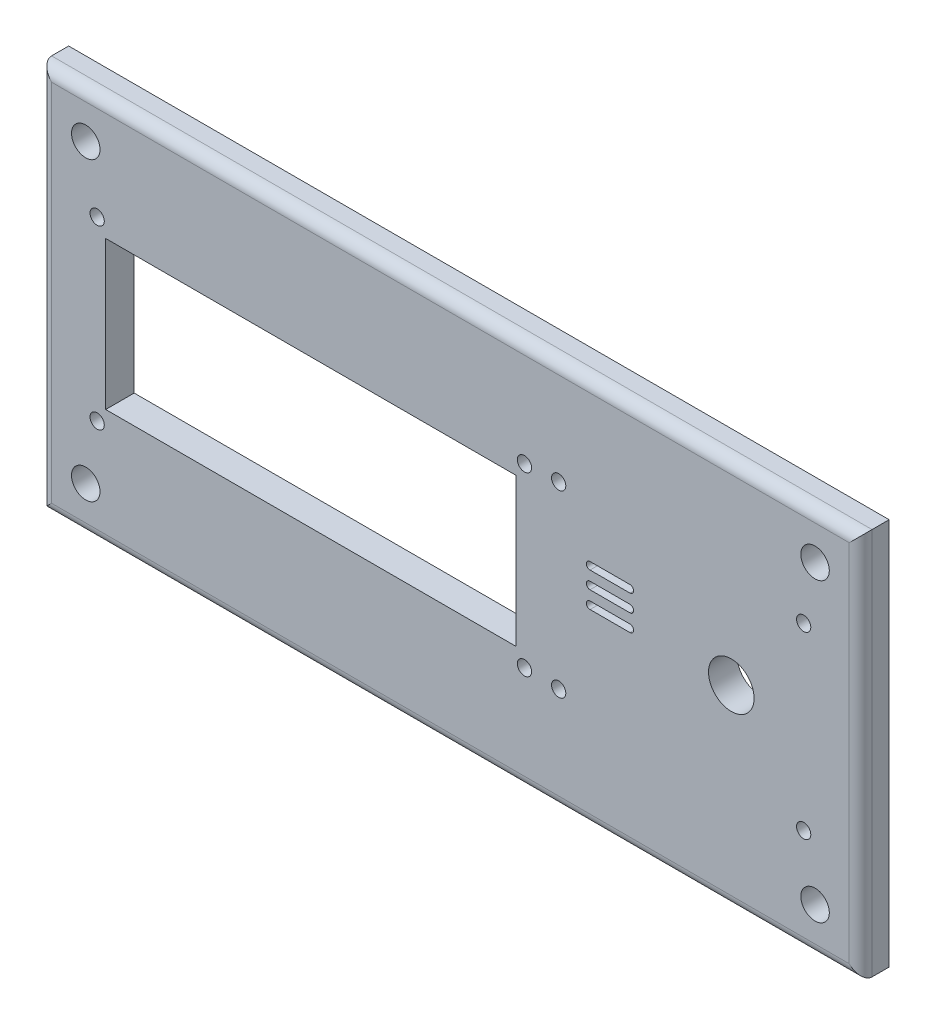
from build123d import *

# Parameters (mm, degrees)
SKETCH_1_W          = 144
SKETCH_1_H          = 68
EXTRUDE_1_DEPTH     = 5
SKETCH_2_R          = 1.25
CUT_EXTRUDE_1_DEPTH = 87.344031922
SKETCH_3_W          = 72
SKETCH_3_H          = 26
CUT_EXTRUDE_2_DEPTH = 87.344031922
SKETCH_5_R          = 1.25
CUT_EXTRUDE_3_DEPTH = 87.344031922
CUT_EXTRUDE_4_DEPTH = 87.344031922
SKETCH_7_R          = 4
CUT_EXTRUDE_5_DEPTH = 87.344031922
SKETCH_8_R          = 2.5
CUT_EXTRUDE_6_DEPTH = 87.344031922
FILLET_1_R          = 2


with BuildPart() as part:
    # Эскиз1 → Бобышка-Вытянуть1 (new body)
    with BuildSketch(Plane.XY):
        with Locations((3.041351056, -8.41565136)):
            Rectangle(SKETCH_1_W, SKETCH_1_H)
    extrude(amount=EXTRUDE_1_DEPTH)

    # Эскиз2 → Вырез-Вытянуть1 (cut, through all)
    with BuildSketch(Plane.XY.offset(5)):
        with Locations((-58.958648944, 7.08434864)):
            Circle(SKETCH_2_R)
        with Locations((-58.958648944, -23.91565136)):
            Circle(SKETCH_2_R)
        with Locations((16.041351056, 7.08434864)):
            Circle(SKETCH_2_R)
        with Locations((16.041351056, -23.91565136)):
            Circle(SKETCH_2_R)
    extrude(amount=-CUT_EXTRUDE_1_DEPTH, mode=Mode.SUBTRACT)

    # Эскиз3 → Вырез-Вытянуть2 (cut, through all)
    with BuildSketch(Plane.XY.offset(5)):
        with Locations((-21.458648944, -8.41565136)):
            Rectangle(SKETCH_3_W, SKETCH_3_H)
    extrude(amount=-CUT_EXTRUDE_2_DEPTH, mode=Mode.SUBTRACT)

    # Эскиз5 → Вырез-Вытянуть3 (cut, through all)
    with BuildSketch(Plane.XY.offset(5)):
        with Locations((22.041351056, -24.16565136)):
            Circle(SKETCH_5_R)
        with Locations((65.041351056, -24.16565136)):
            Circle(SKETCH_5_R)
        with Locations((65.041351056, 7.33434864)):
            Circle(SKETCH_5_R)
        with Locations((22.041351056, 7.33434864)):
            Circle(SKETCH_5_R)
    extrude(amount=-CUT_EXTRUDE_3_DEPTH, mode=Mode.SUBTRACT)

    # Эскиз6 → Вырез-Вытянуть4 (cut, through all)
    with BuildSketch(Plane.XY.offset(5)):
        with BuildLine():
            Line((27.541351056, -8.016688712), (34.541351056, -8.016688712))
            ThreePointArc((34.541351056, -8.016688712), (35.190313704, -8.66565136), (34.541351056, -9.314614008))
            Line((34.541351056, -9.314614008), (27.541351056, -9.314614008))
            ThreePointArc((27.541351056, -9.314614008), (26.892388408, -8.66565136), (27.541351056, -8.016688712))
        make_face()
        with BuildLine():
            Line((27.541351056, -5.016688712), (34.541351056, -5.016688712))
            ThreePointArc((34.541351056, -5.016688712), (35.190313704, -5.66565136), (34.541351056, -6.314614008))
            Line((34.541351056, -6.314614008), (27.541351056, -6.314614008))
            ThreePointArc((27.541351056, -6.314614008), (26.892388408, -5.66565136), (27.541351056, -5.016688712))
        make_face()
        with BuildLine():
            Line((27.541351056, -2.016688712), (34.541351056, -2.016688712))
            ThreePointArc((34.541351056, -2.016688712), (35.190313704, -2.66565136), (34.541351056, -3.314614008))
            Line((34.541351056, -3.314614008), (27.541351056, -3.314614008))
            ThreePointArc((27.541351056, -3.314614008), (26.892388408, -2.66565136), (27.541351056, -2.016688712))
        make_face()
    extrude(amount=-CUT_EXTRUDE_4_DEPTH, mode=Mode.SUBTRACT)

    # Эскиз7 → Вырез-Вытянуть5 (cut, through all)
    with BuildSketch(Plane.XY.offset(5)):
        with Locations((52.341351056, -8.41565136)):
            Circle(SKETCH_7_R)
    extrude(amount=-CUT_EXTRUDE_5_DEPTH, mode=Mode.SUBTRACT)

    # Эскиз8 → Вырез-Вытянуть6 (cut, through all)
    with BuildSketch(Plane.XY.offset(5)):
        with Locations((-60.958648944, 17.58434864)):
            Circle(SKETCH_8_R)
        with Locations((67.041351056, 17.58434864)):
            Circle(SKETCH_8_R)
        with Locations((67.041351056, -34.41565136)):
            Circle(SKETCH_8_R)
        with Locations((-60.958648944, -34.41565136)):
            Circle(SKETCH_8_R)
    extrude(amount=-CUT_EXTRUDE_6_DEPTH, mode=Mode.SUBTRACT)

    # Скругление1
    fillet_1_edges = [part.edges().sort_by_distance(p)[0] for p in [
        (75.041351056, -8.41565136, 5),
        (3.041351056, 25.58434864, 5),
        (-68.958648944, -8.41565136, 5),
        (3.041351056, -42.41565136, 5),
    ]]
    fillet(fillet_1_edges, radius=FILLET_1_R)


solid = part.part
